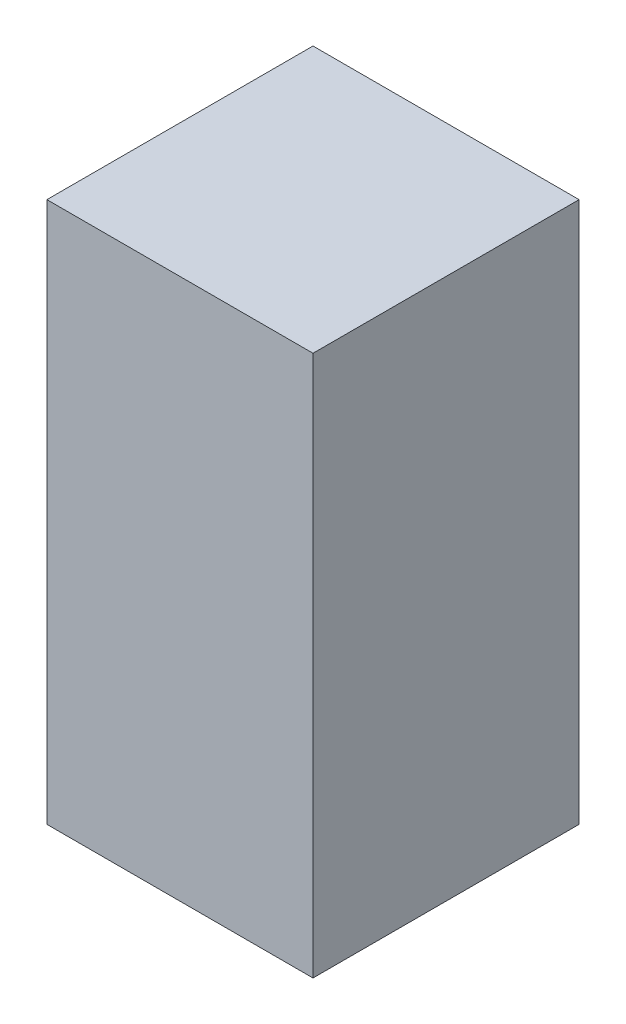
from build123d import *

# Parameters (mm, degrees)
SKETCH1_W           = 300
SKETCH1_H           = 300
BOSS_EXTRUDE1_DEPTH = 610


with BuildPart() as part:
    # Sketch1 → Boss-Extrude1 (new body)
    with BuildSketch(Plane(origin=(0, 0, 0), x_dir=(1, 0, 0), z_dir=(0, 1, 0))):
        Rectangle(SKETCH1_W, SKETCH1_H)
    extrude(amount=BOSS_EXTRUDE1_DEPTH)


solid = part.part
